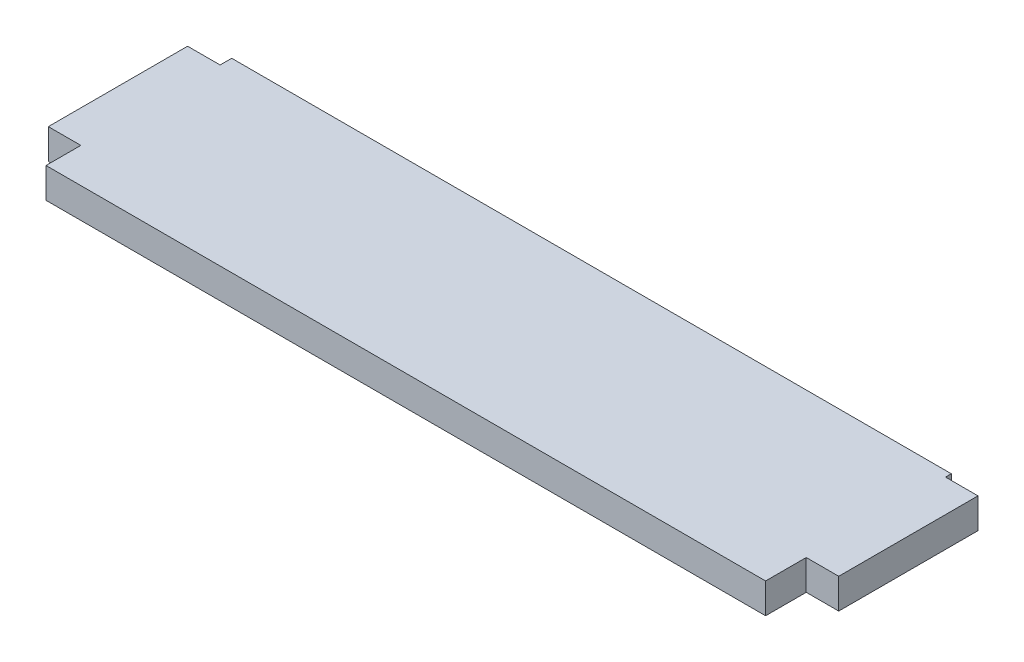
from build123d import *

# Parameters (mm, degrees)
SKETCH1_W           = 31
SKETCH1_H           = 8
BOSS_EXTRUDE1_DEPTH = 1.3
SKETCH2_W           = 1.4
SKETCH2_H           = 6
BOSS_EXTRUDE2_DEPTH = 1.3


with BuildPart() as part:
    # Sketch1 → Boss-Extrude1 (new body)
    with BuildSketch(Plane(origin=(0, 0, 0), x_dir=(1, 0, 0), z_dir=(0, 1, 0))):
        Rectangle(SKETCH1_W, SKETCH1_H)
    extrude(amount=BOSS_EXTRUDE1_DEPTH)

    # Sketch2 → Boss-Extrude2 (add)
    with BuildSketch(Plane(origin=(0, 0, 0), x_dir=(1, 0, 0), z_dir=(0, 1, 0))):
        with Locations((-16.2, 0.5)):
            Rectangle(SKETCH2_W, SKETCH2_H)
        with Locations((16.2, 0.75)):
            Rectangle(SKETCH2_W, SKETCH2_H)
    extrude(amount=BOSS_EXTRUDE2_DEPTH)


solid = part.part
